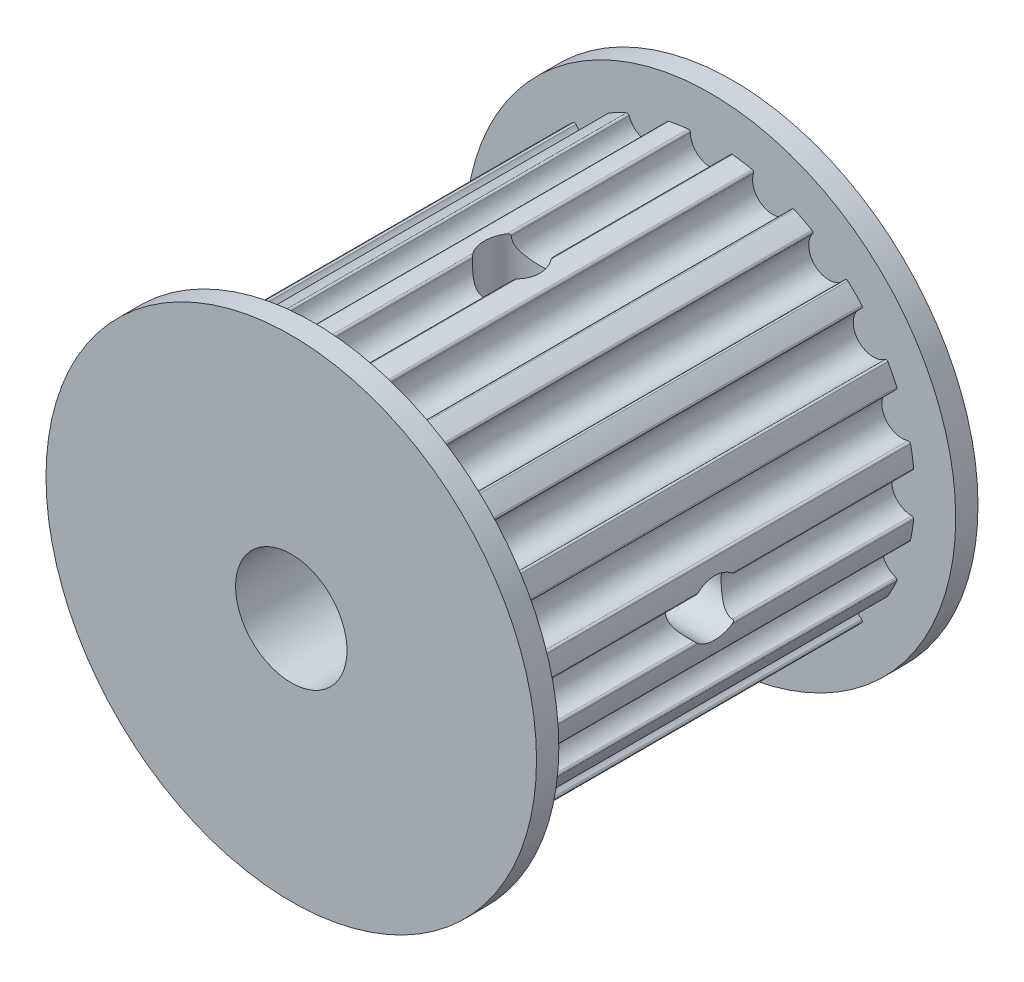
from build123d import *

# Parameters (mm, degrees)
SKETCH_01_W               = 17.8
SKETCH_01_H               = 9.16761094
CUT_EXTRUDE_START         = -11.5
CUT_EXTRUDE_01_DEPTH      = 18
PATTERN_CIRCULAR_01_COUNT = 20
SKETCH_5_R                = 11
EXTRUDE_1_DEPTH           = 1
EXTRUDE_START             = 1
SKETCH_6_R                = 11
EXTRUDE_2_DEPTH           = 1
SKETCH_7_R                = 2.5
CUT_EXTRUDE_2_DEPTH       = 26.180150913
HOLE_WIZARD_M3_1_D        = 2.5
HOLE_WIZARD_M3_1_DEPTH    = 7.5
HOLE_WIZARD_M3_1_TIP      = 0.751075774
HOLE_WIZARD_M3_2_D        = 2.5
HOLE_WIZARD_M3_2_DEPTH    = 7.5
HOLE_WIZARD_M3_2_TIP      = 0.751075774


with BuildPart() as part:
    # Sketch 01 → 同步带轮01 (revolve)
    with BuildSketch(Plane(origin=(0, 0, 0), x_dir=(0, 0, -1), z_dir=(1, 0, 0))):
        with Locations((2.499200096, 4.58380547)):
            Rectangle(SKETCH_01_W, SKETCH_01_H)
    revolve(axis=Axis((0, 0, 0), (0, 0, -1)))

    # Sketch 01 2 → 齿拉伸切除同步带轮01 (cut)
    with BuildSketch(Plane.XY.offset(CUT_EXTRUDE_START)):
        with BuildLine():
            Line((-0.993647123, 9.113602786), (0, 11.707610902))
            Line((0, 11.707610902), (0.993647123, 9.113602786))
            ThreePointArc((0.993647123, 9.113602786), (0.92807693, 9.09250851), (0.899999986, 9.029610942))
            ThreePointArc((0.899999986, 9.029610942), (0, 8.129610956), (-0.899999986, 9.029610942))
            ThreePointArc((-0.899999986, 9.029610942), (-0.92807693, 9.09250851), (-0.993647123, 9.113602786))
        make_face()
    cut_extrude_01 = extrude(amount=CUT_EXTRUDE_01_DEPTH, mode=Mode.SUBTRACT)

    # 齿形同步带轮01: 齿拉伸切除同步带轮01 ×20 about axis
    pattern_circular_01_axis = Axis((0, 0, 55), (0, 0, -1))
    for i in range(1, PATTERN_CIRCULAR_01_COUNT):
        add(cut_extrude_01.rotate(pattern_circular_01_axis, i * 360 / PATTERN_CIRCULAR_01_COUNT), mode=Mode.SUBTRACT)

    # 草图5 → 凸台-拉伸1 (add)
    with BuildSketch(Plane.XY.offset(6.400799904)):
        Circle(SKETCH_5_R)
    extrude(amount=EXTRUDE_1_DEPTH)

    # 草图6 → 凸台-拉伸2 (add)
    with BuildSketch(Plane(origin=(0, 0, -11.399200096), x_dir=(-1, 0, 0), z_dir=(0, 0, -1)).offset(EXTRUDE_START)):
        Circle(SKETCH_6_R)
    extrude(amount=-EXTRUDE_2_DEPTH)

    # 草图7 → 切除-拉伸2 (cut, through all)
    with BuildSketch(Plane(origin=(0, 0, -12.399200096), x_dir=(-1, 0, 0), z_dir=(0, 0, -1))):
        Circle(SKETCH_7_R)
    extrude(amount=-CUT_EXTRUDE_2_DEPTH, mode=Mode.SUBTRACT)

    # M3 螺纹孔1
    with Locations(Plane(origin=(0, 9.16761094, -2.499200096), x_dir=(1, 0, 0), z_dir=(0, 1, 0))):
        with Locations((0, 0)):
            Hole(HOLE_WIZARD_M3_1_D / 2, depth=HOLE_WIZARD_M3_1_DEPTH)
            with Locations((0, 0, -(HOLE_WIZARD_M3_1_DEPTH + HOLE_WIZARD_M3_1_TIP / 2))):  # 118° drill point
                Cone(0, HOLE_WIZARD_M3_1_D / 2, HOLE_WIZARD_M3_1_TIP, mode=Mode.SUBTRACT)

    # M3 螺纹孔2
    with Locations(Plane(origin=(9.16761094, 0, -2.499200096), x_dir=(0, 0, 1), z_dir=(1, 0, 0))):
        with Locations((0, 0)):
            Hole(HOLE_WIZARD_M3_2_D / 2, depth=HOLE_WIZARD_M3_2_DEPTH)
            with Locations((0, 0, -(HOLE_WIZARD_M3_2_DEPTH + HOLE_WIZARD_M3_2_TIP / 2))):  # 118° drill point
                Cone(0, HOLE_WIZARD_M3_2_D / 2, HOLE_WIZARD_M3_2_TIP, mode=Mode.SUBTRACT)


solid = part.part
